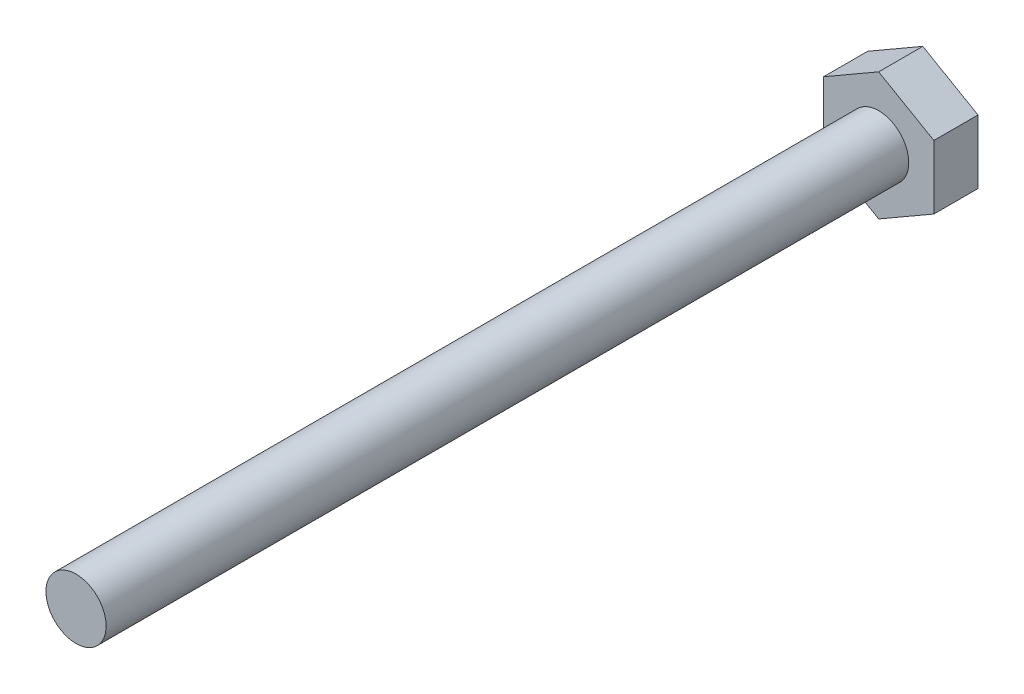
from build123d import *

# Parameters (mm, degrees)
SKETCH_1_R               = 1.5
EXTRUDE_3_DEPTH          = 2.2
SKETCH_1_6_R             = 1.5
EXTRUDE_4_DEPTH          = 42.2
CUT_EXTRUDE_1_DEPTH      = 1
CUT_EXTRUDE_1_DEPTH_BACK = 1


with BuildPart() as part:
    # 草图1 → 凸台-拉伸3 (new body)
    with BuildSketch(Plane.XY):
        Polygon((-2.75, -1.58771324), (0, -3.175426481), (2.75, -1.58771324), (2.75, 1.58771324), (0, 3.175426481), (-2.75, 1.58771324), align=None)
        Circle(SKETCH_1_R, mode=Mode.SUBTRACT)
    extrude(amount=EXTRUDE_3_DEPTH)

    # 草图1<6> → 凸台-拉伸4 (add)
    with BuildSketch(Plane.XY):
        Circle(SKETCH_1_6_R)
    extrude(amount=EXTRUDE_4_DEPTH)

    # 草图1<9> → 切除-拉伸1 (cut, two sides: drawn at the far end of the back side and taken through both)
    with BuildSketch(Plane.XY.offset(-CUT_EXTRUDE_1_DEPTH_BACK)):
        Polygon((0.249002884, 0.249002884), (0.249002884, 0.902887914), (-0.249002884, 0.902887914), (-0.249002884, 0.249002884), (-0.902887914, 0.249002884), (-0.902887914, -0.249002884), (-0.249002884, -0.249002884), (-0.249002884, -0.902887914), (0.249002884, -0.902887914), (0.249002884, -0.249002884), (0.902887914, -0.249002884), (0.902887914, 0.249002884), align=None)
    extrude(amount=CUT_EXTRUDE_1_DEPTH + CUT_EXTRUDE_1_DEPTH_BACK, mode=Mode.SUBTRACT)


solid = part.part
